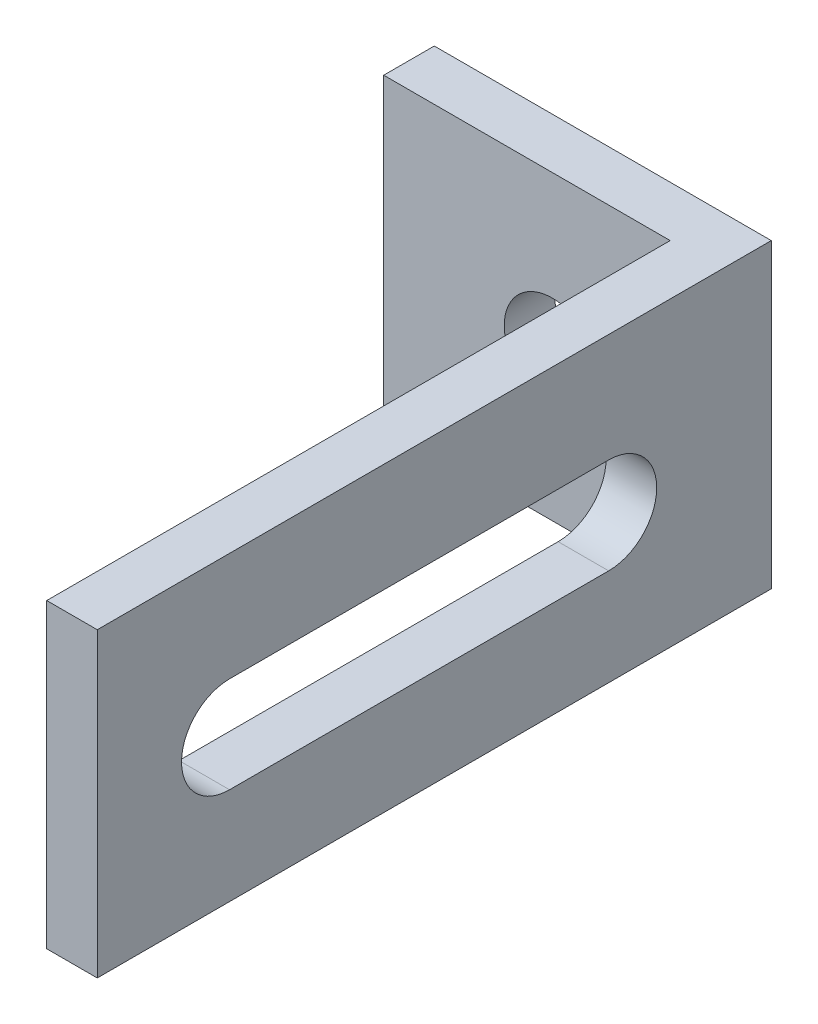
from build123d import *

# Parameters (mm, degrees)
SKETCH_1_W          = 20
SKETCH_1_H          = 17.9
SKETCH_1_R          = 2.85
EXTRUDE_1_DEPTH     = 3
SKETCH_2_W          = 3
SKETCH_2_H          = 17.9
EXTRUDE_2_DEPTH     = 37
CUT_EXTRUDE_1_DEPTH = 37


with BuildPart() as part:
    # 草图1 → 凸台-拉伸1 (new body)
    with BuildSketch(Plane.XY):
        Rectangle(SKETCH_1_W, SKETCH_1_H)
        with Locations((0, -0.35)):
            Circle(SKETCH_1_R, mode=Mode.SUBTRACT)
    extrude(amount=EXTRUDE_1_DEPTH)

    # 草图2 → 凸台-拉伸2 (add)
    with BuildSketch(Plane.XY.offset(3)):
        with Locations((8.5, 0)):
            Rectangle(SKETCH_2_W, SKETCH_2_H)
    extrude(amount=EXTRUDE_2_DEPTH)

    # 草图3 → 切除-拉伸1 (cut)
    with BuildSketch(Plane.ZY.offset(-7)):
        with BuildLine():
            Line((32.15, -3.2), (9.65, -3.2))
            ThreePointArc((9.65, -3.2), (6.8, -0.35), (9.65, 2.5))
            Line((9.65, 2.5), (32.15, 2.5))
            ThreePointArc((32.15, 2.5), (35, -0.35), (32.15, -3.2))
        make_face()
    extrude(amount=-CUT_EXTRUDE_1_DEPTH, mode=Mode.SUBTRACT)


solid = part.part
